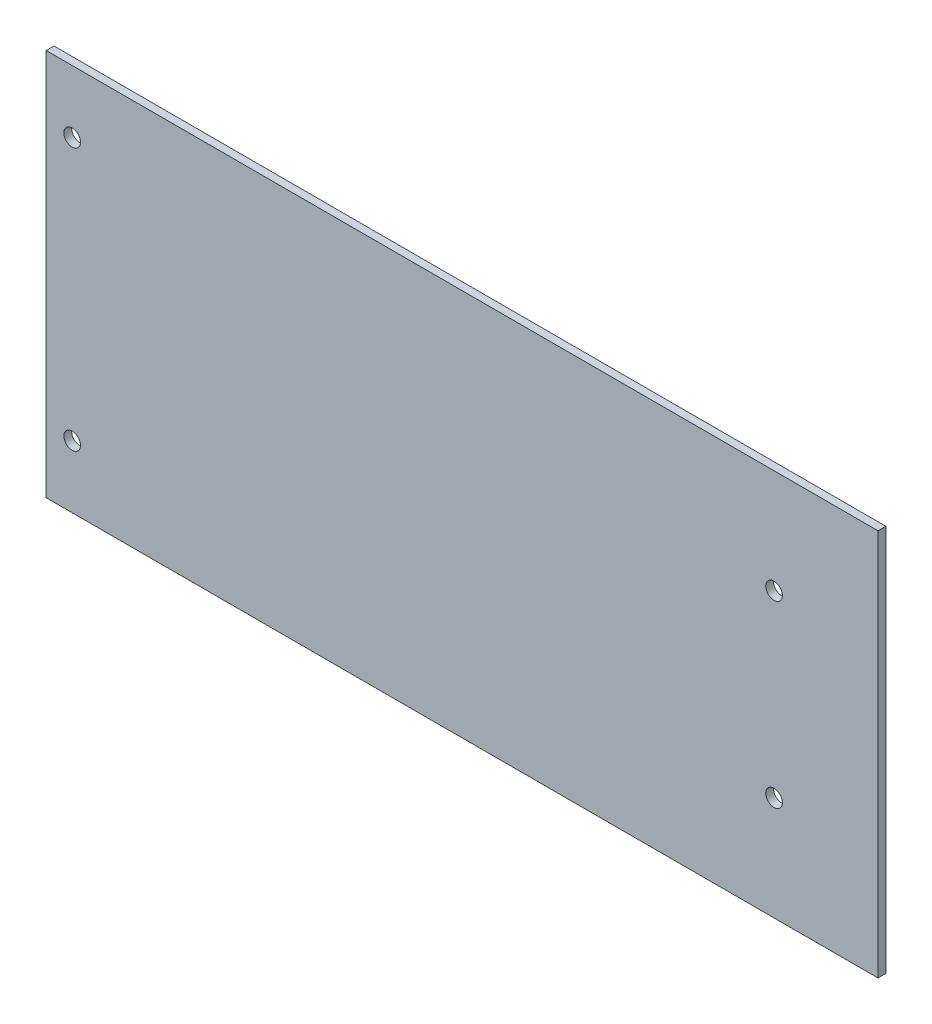
from build123d import *

# Parameters (mm, degrees)
SKETCH1_W           = 160
SKETCH1_H           = 74.5
SKETCH1_R           = 1.6
BOSS_EXTRUDE1_DEPTH = 1.5


with BuildPart() as part:
    # Sketch1 → Boss-Extrude1 (new body)
    with BuildSketch(Plane.XY):
        with Locations((10.037232686, 37.25)):
            Rectangle(SKETCH1_W, SKETCH1_H)
        with Locations((70.037232686, 54.5)):
            Circle(SKETCH1_R, mode=Mode.SUBTRACT)
        with Locations((70.037232686, 20)):
            Circle(SKETCH1_R, mode=Mode.SUBTRACT)
        with Locations((-64.962767314, 62.5)):
            Circle(SKETCH1_R, mode=Mode.SUBTRACT)
        with Locations((-64.962767314, 12)):
            Circle(SKETCH1_R, mode=Mode.SUBTRACT)
    extrude(amount=BOSS_EXTRUDE1_DEPTH)


solid = part.part
